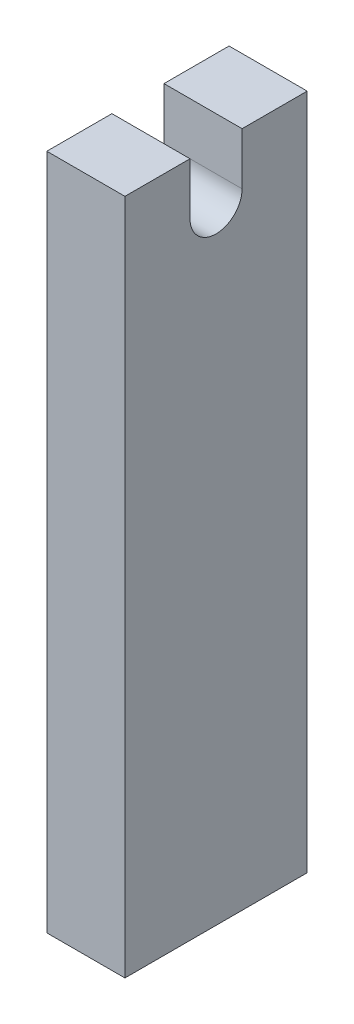
from build123d import *

# Parameters (mm, degrees)
SKETCH1_W           = 38.1
SKETCH1_H           = 88.9
BOSS_EXTRUDE1_DEPTH = 330.2
CUT_EXTRUDE1_DEPTH  = 381


with BuildPart() as part:
    # Sketch1 → Boss-Extrude1 (new body)
    with BuildSketch(Plane(origin=(0, 0, 0), x_dir=(1, 0, 0), z_dir=(0, 1, 0))):
        with Locations((19.05, 44.45)):
            Rectangle(SKETCH1_W, SKETCH1_H)
    extrude(amount=BOSS_EXTRUDE1_DEPTH)

    # Sketch2 → Cut-Extrude1 (cut)
    with BuildSketch(Plane(origin=(38.1, 0, 0), x_dir=(0, 0, -1), z_dir=(1, 0, 0))):
        with BuildLine():
            Line((57.15, 330.2), (57.15, 304.8))
            ThreePointArc((57.15, 304.8), (44.45, 292.1), (31.75, 304.8))
            Line((31.75, 304.8), (31.75, 330.2))
            ThreePointArc((31.75, 330.2), (44.45, 342.9), (57.15, 330.2))
        make_face()
    extrude(amount=-CUT_EXTRUDE1_DEPTH, mode=Mode.SUBTRACT)


solid = part.part
